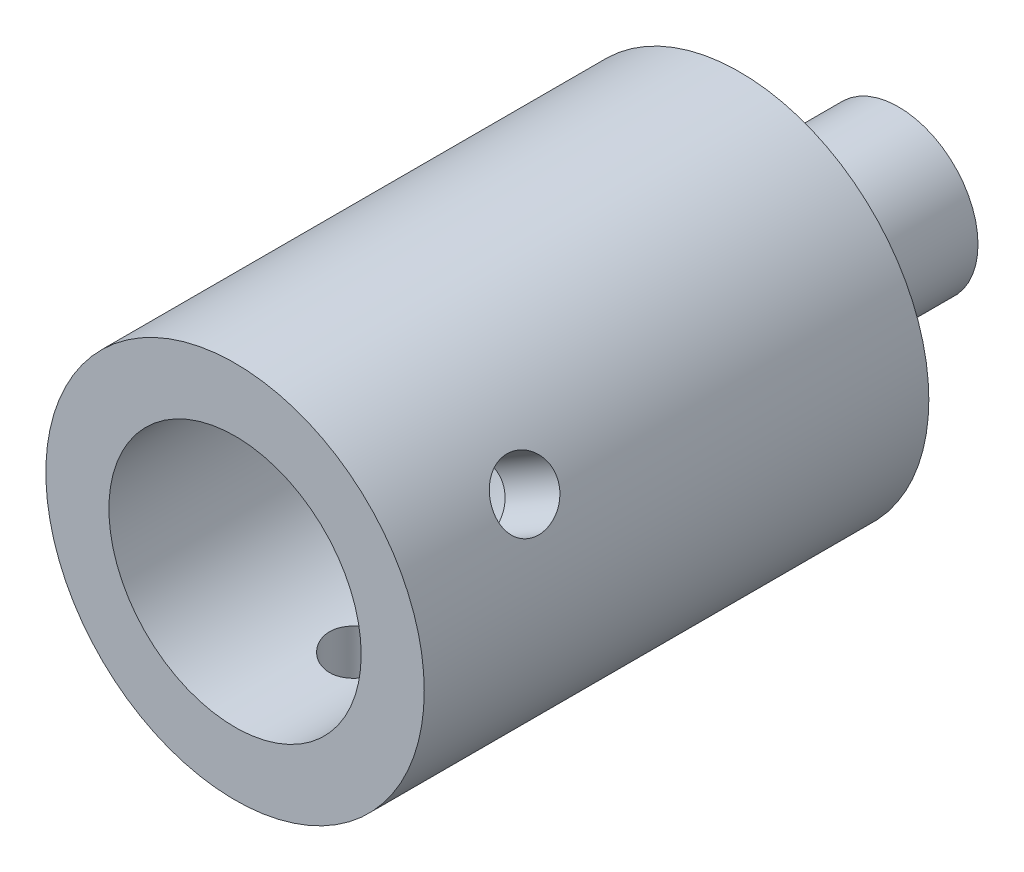
from build123d import *

# Parameters (mm, degrees)
SKETCH1_R           = 4
BOSS_EXTRUDE1_DEPTH = 7
SKETCH2_R           = 5.5
BOSS_EXTRUDE2_DEPTH = 1
SKETCH3_R           = 9.525
BOSS_EXTRUDE3_DEPTH = 25.4
SKETCH4_R           = 6.35
CUT_EXTRUDE1_DEPTH  = 19.05
SKETCH5_R           = 1.5875
CUT_EXTRUDE2_DEPTH  = 25.4
CIRPATTERN1_COUNT   = 3


with BuildPart() as part:
    # Sketch1 → Boss-Extrude1 (new body)
    with BuildSketch(Plane.XY):
        Circle(SKETCH1_R)
    extrude(amount=BOSS_EXTRUDE1_DEPTH)

    # Sketch2 → Boss-Extrude2 (add)
    with BuildSketch(Plane.XY.offset(7)):
        Circle(SKETCH2_R)
    extrude(amount=BOSS_EXTRUDE2_DEPTH)

    # Sketch3 → Boss-Extrude3 (add)
    with BuildSketch(Plane.XY.offset(8)):
        Circle(SKETCH3_R)
    extrude(amount=BOSS_EXTRUDE3_DEPTH)

    # Sketch4 → Cut-Extrude1 (cut)
    with BuildSketch(Plane.XY.offset(33.4)):
        Circle(SKETCH4_R)
    extrude(amount=-CUT_EXTRUDE1_DEPTH, mode=Mode.SUBTRACT)

    # Sketch5 → Cut-Extrude2 (cut)
    with BuildSketch(Plane(origin=(0, 0, 0), x_dir=(1, 0, 0), z_dir=(0, 1, 0))):
        with Locations(Location((0, -27.05, 0), (0, 0, 270))):
            Circle(SKETCH5_R)
    cut_extrude2 = extrude(amount=-CUT_EXTRUDE2_DEPTH, mode=Mode.SUBTRACT)

    # CirPattern1: Cut-Extrude2 ×3 about axis
    cirpattern1_axis = Axis((0, 0, 33.4), (0, 0, -1))
    for i in range(1, CIRPATTERN1_COUNT):
        add(cut_extrude2.rotate(cirpattern1_axis, i * 360 / CIRPATTERN1_COUNT), mode=Mode.SUBTRACT)


solid = part.part
